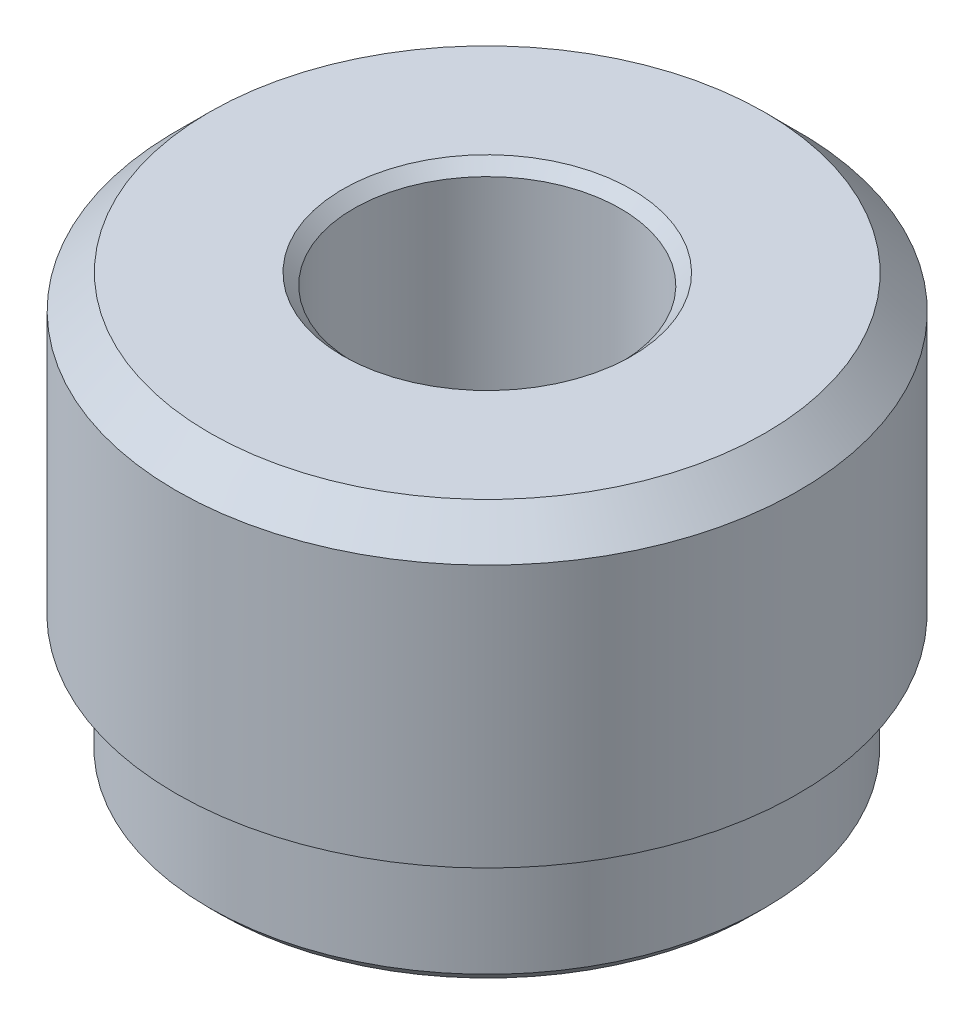
from build123d import *


with BuildPart() as part:
    # Esquisse1 → Base-Révolution (revolve)
    with BuildSketch(Plane(origin=(0, 0.557099225, 739.962502514), x_dir=(-1, 0, 0), z_dir=(0, -0.0007528747265126423, -0.9999997165897829)), mode=Mode.PRIVATE) as base_r_volution_sk:
        Polygon((-2199.400204284, 598.95640538), (-2198.900204284, 599.456870076), (-2198.908564931, 617.456867811), (-2199.408564931, 617.956403546), (-2205.408099158, 617.95361688), (-2206.908099158, 616.452222791), (-2206.902618614, 604.65292127), (-2205.402618773, 604.653617991), (-2205.400203367, 599.453386473), (-2204.900203367, 598.953850738), align=None)
    revolve(base_r_volution_sk.sketch.rotate(Axis((2192.899970054, 599.510903709, 739.511565204), (0.0004644803890833411, 0.9999996087187918, -0.0007528746453008684)), 270), axis=Axis((2192.899970054, 599.510903709, 739.511565204), (0.0004644803890833411, 0.9999996087187918, -0.0007528746453008684)))


solid = part.part
